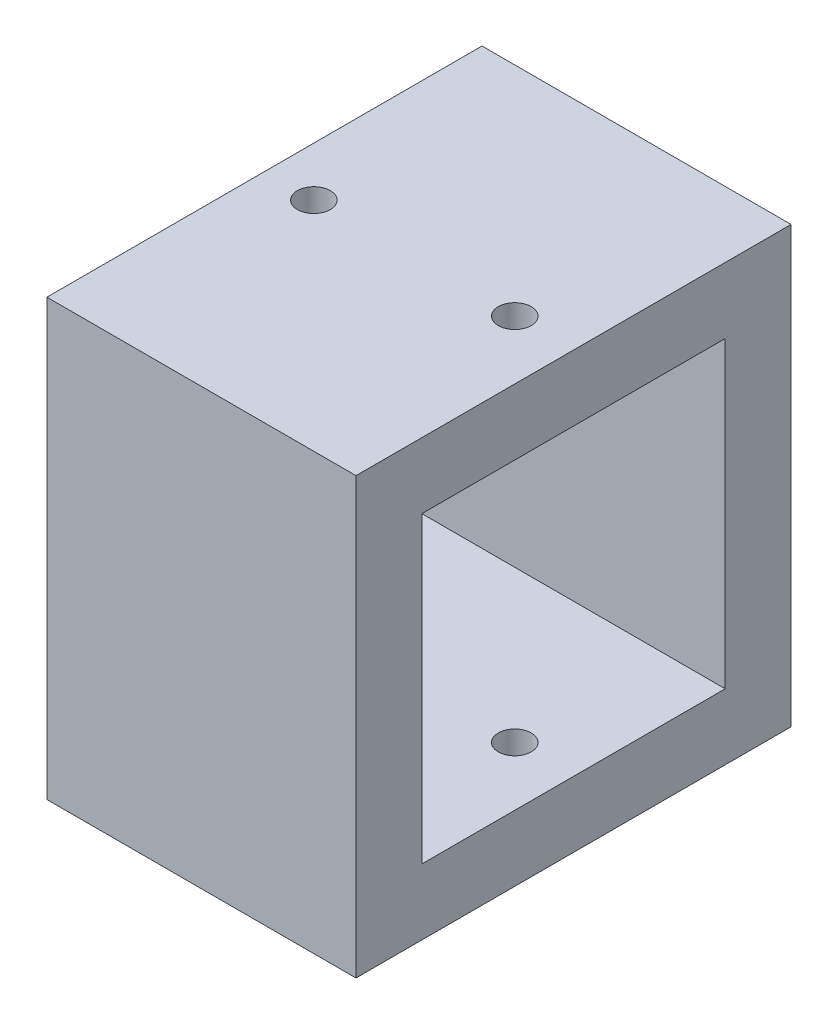
from build123d import *

# Parameters (mm, degrees)
SKETCH1_W           = 33.554975054
SKETCH1_H           = 33.554975054
SKETCH1_W_2         = 23.394975054
SKETCH1_H_2         = 23.394975054
BOSS_EXTRUDE1_DEPTH = 23.837801194
SKETCH2_R           = 1.27
CUT_EXTRUDE1_DEPTH  = 46.216489821


with BuildPart() as part:
    # Sketch1 → Boss-Extrude1 (new body)
    with BuildSketch(Plane(origin=(0, 0, 0), x_dir=(0, 0, -1), z_dir=(1, 0, 0))):
        with Locations((1.94025366, 7.818080922)):
            Rectangle(SKETCH1_W, SKETCH1_H)
        with Locations((1.94025366, 7.818080922)):
            Rectangle(SKETCH1_W_2, SKETCH1_H_2, mode=Mode.SUBTRACT)
    extrude(amount=BOSS_EXTRUDE1_DEPTH)

    # Sketch2 → Cut-Extrude1 (cut, through all)
    with BuildSketch(Plane.XZ.offset(8.959406605)):
        with Locations(Location((3.81, -1.94025366, 0), (0, 0, 270))):
            Circle(SKETCH2_R)
        with Locations(Location((19.304, -1.94025366, 0), (0, 0, 270))):
            Circle(SKETCH2_R)
    extrude(amount=-CUT_EXTRUDE1_DEPTH, mode=Mode.SUBTRACT)


solid = part.part
